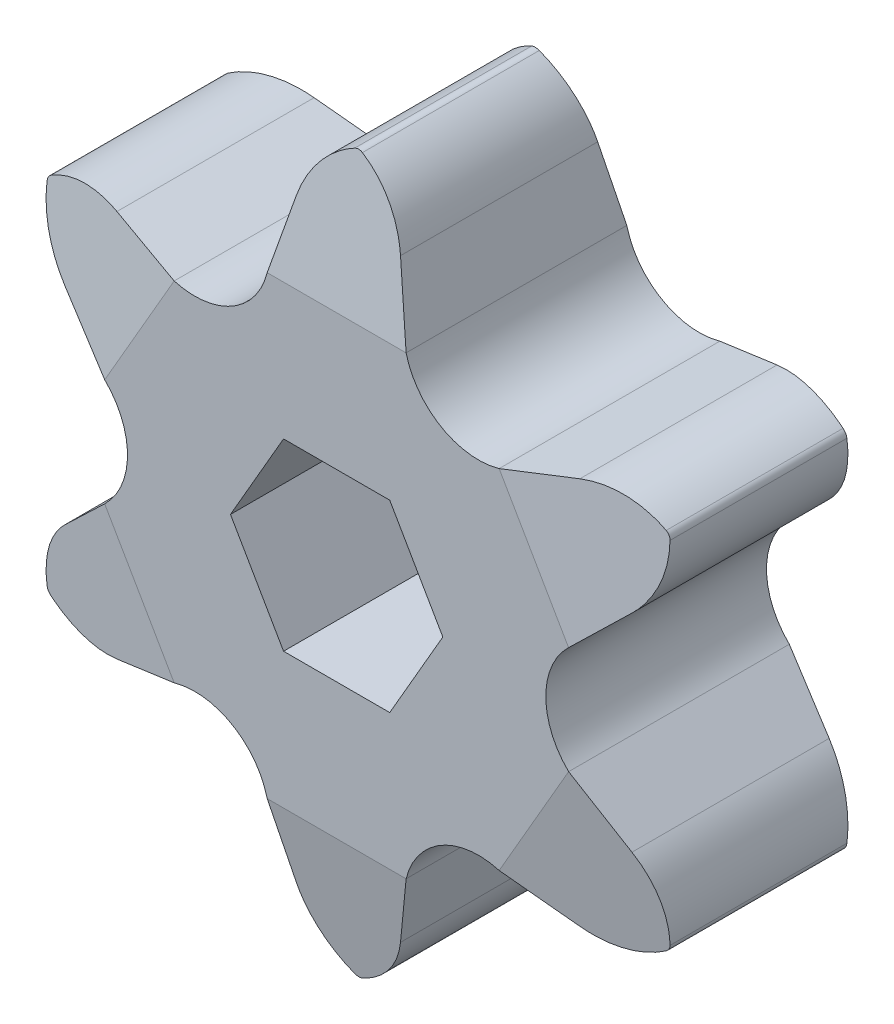
from build123d import *

# Parameters (mm, degrees)
BOSS_EXTRUDE1_DEPTH     = 3.81
CUT_EXTRUDE1_DEPTH      = 18.281637299
CIRPATTERN1_COUNT       = 6
MIRROR1_COPY_1_DEPTH    = 18.281637299
MIRROR1_COPY_2_DEPTH    = 18.281637299
MIRROR1_COPY_3_DEPTH    = 18.281637299
MIRROR1_COPY_4_DEPTH    = 18.281637299
MIRROR1_COPY_5_DEPTH    = 18.281637299
CUT_EXTRUDE2_DEPTH      = 19.498737463
CUT_EXTRUDE2_DEPTH_BACK = 19.498737463


with BuildPart() as part:
    # Sketch1 → Boss-Extrude1 (new, symmetric)
    with BuildSketch(Plane.XY):
        with BuildLine():
            Line((-5.026722801, 5.910971637), (-7.407741623, 6.593717798))
            ThreePointArc((-7.407741623, 6.593717798), (-8.766513969, 6.679662371), (-10.036356458, 6.18859332))
            ThreePointArc((-10.036356458, 6.18859332), (-10.13048223, 6.088494289), (-10.170107647, 5.956929464))
            ThreePointArc((-10.170107647, 5.956929464), (-9.960464677, 4.611679084), (-9.20664832, 3.477920001))
            Line((-9.20664832, 3.477920001), (-7.424863389, 1.757270295))
            ThreePointArc((-7.424863389, 1.757270295), (-7.270818157, 1.595014723), (-7.131420667, 1.420014312))
            ThreePointArc((-7.131420667, 1.420014312), (-6.637662134, -0.097259644), (-7.131420667, -1.6145336))
            ThreePointArc((-7.131420667, -1.6145336), (-7.270818157, -1.789534012), (-7.424863389, -1.951789584))
            Line((-7.424863389, -1.951789584), (-9.20664832, -3.67243929))
            ThreePointArc((-9.20664832, -3.67243929), (-9.960464677, -4.806198373), (-10.170107647, -6.151448752))
            ThreePointArc((-10.170107647, -6.151448752), (-10.13048223, -6.283013578), (-10.036356458, -6.383112608))
            ThreePointArc((-10.036356458, -6.383112608), (-8.766513969, -6.87418166), (-7.407741623, -6.788237086))
            Line((-7.407741623, -6.788237086), (-5.026722801, -6.105490926))
            ThreePointArc((-5.026722801, -6.105490926), (-4.809182738, -6.053211627), (-4.587929191, -6.019990065))
            ThreePointArc((-4.587929191, -6.019990065), (-3.027052134, -6.351019611), (-1.95993361, -7.537264021))
            ThreePointArc((-1.95993361, -7.537264021), (-1.878077553, -7.745485994), (-1.814582722, -7.960020865))
            Line((-1.814582722, -7.960020865), (-1.215348831, -10.363416732))
            ThreePointArc((-1.215348831, -10.363416732), (-0.610392842, -11.583120388), (0.449806676, -12.437301716))
            ThreePointArc((0.449806676, -12.437301716), (0.583557866, -12.468767511), (0.717309055, -12.437301716))
            ThreePointArc((0.717309055, -12.437301716), (1.777508573, -11.583120388), (2.382464562, -10.363416732))
            Line((2.382464562, -10.363416732), (2.981698454, -7.960020865))
            ThreePointArc((2.981698454, -7.960020865), (3.045193285, -7.745485994), (3.127049342, -7.537264021))
            ThreePointArc((3.127049342, -7.537264021), (4.194167866, -6.351019611), (5.755044922, -6.019990065))
            ThreePointArc((5.755044922, -6.019990065), (5.976298469, -6.053211627), (6.193838533, -6.105490926))
            Line((6.193838533, -6.105490926), (8.574857355, -6.788237086))
            ThreePointArc((8.574857355, -6.788237086), (9.933629701, -6.87418166), (11.203472189, -6.383112608))
            ThreePointArc((11.203472189, -6.383112608), (11.297597962, -6.283013578), (11.337223379, -6.151448752))
            ThreePointArc((11.337223379, -6.151448752), (11.127580408, -4.806198373), (10.373764051, -3.67243929))
            Line((10.373764051, -3.67243929), (8.591979121, -1.951789584))
            ThreePointArc((8.591979121, -1.951789584), (8.437933888, -1.789534012), (8.298536398, -1.6145336))
            ThreePointArc((8.298536398, -1.6145336), (7.804777866, -0.097259644), (8.298536398, 1.420014312))
            ThreePointArc((8.298536398, 1.420014312), (8.437933888, 1.595014723), (8.591979121, 1.757270295))
            Line((8.591979121, 1.757270295), (10.373764051, 3.477920001))
            ThreePointArc((10.373764051, 3.477920001), (11.127580408, 4.611679084), (11.337223379, 5.956929464))
            ThreePointArc((11.337223379, 5.956929464), (11.297597962, 6.088494289), (11.203472189, 6.18859332))
            ThreePointArc((11.203472189, 6.18859332), (9.933629701, 6.679662371), (8.574857355, 6.593717798))
            Line((8.574857355, 6.593717798), (6.193838533, 5.910971637))
            ThreePointArc((6.193838533, 5.910971637), (5.976298469, 5.858692338), (5.755044922, 5.825470777))
            ThreePointArc((5.755044922, 5.825470777), (4.194167866, 6.156500322), (3.127049342, 7.342744732))
            ThreePointArc((3.127049342, 7.342744732), (3.045193285, 7.550966706), (2.981698454, 7.765501576))
            Line((2.981698454, 7.765501576), (2.382464562, 10.168897443))
            ThreePointArc((2.382464562, 10.168897443), (1.777508573, 11.3886011), (0.717309055, 12.242782428))
            ThreePointArc((0.717309055, 12.242782428), (0.583557866, 12.274248223), (0.449806676, 12.242782428))
            ThreePointArc((0.449806676, 12.242782428), (-0.610392842, 11.3886011), (-1.215348831, 10.168897443))
            Line((-1.215348831, 10.168897443), (-1.814582722, 7.765501576))
            ThreePointArc((-1.814582722, 7.765501576), (-1.878077553, 7.550966706), (-1.95993361, 7.342744732))
            ThreePointArc((-1.95993361, 7.342744732), (-3.027052134, 6.156500322), (-4.587929191, 5.825470777))
            ThreePointArc((-4.587929191, 5.825470777), (-4.809182738, 5.858692338), (-5.026722801, 5.910971637))
        make_face()
    extrude(amount=BOSS_EXTRUDE1_DEPTH, both=True)

    # Sketch2 → Cut-Extrude1 (cut, symmetric)
    with BuildSketch(Plane(origin=(0, 0, 0), x_dir=(0, 0, -1), z_dir=(1, 0, 0))):
        Polygon((-3.048, 12.274248223), (-3.81, 7.765501576), (-3.81, 12.274248223), align=None)
    cut_extrude1 = extrude(amount=CUT_EXTRUDE1_DEPTH, both=True, mode=Mode.SUBTRACT)

    # CirPattern1: Cut-Extrude1 ×6 about axis
    cirpattern1_axis = Axis((0.583557866, -0.097259644, -4.191), (0, 0, 1))
    for i in range(1, CIRPATTERN1_COUNT):
        add(cut_extrude1.rotate(cirpattern1_axis, i * 360 / CIRPATTERN1_COUNT), mode=Mode.SUBTRACT)

    # Mirror1: Cut-Extrude1 across plane
    add(cut_extrude1.mirror(Plane.XY), mode=Mode.SUBTRACT)

    # Mirror1 copy 1 sketch → Mirror1 copy 1 (cut, symmetric)
    with BuildSketch(Plane(origin=(0.20754961, -0.554005758, 0), x_dir=(0, 0, 1), z_dir=(0.5000000000000001, 0.8660254037844386, 0))):
        Polygon((-3.048, -12.274248223), (-3.81, -7.765501576), (-3.81, -12.274248223), align=None)
    extrude(amount=MIRROR1_COPY_1_DEPTH, both=True, mode=Mode.SUBTRACT)

    # Mirror1 copy 2 sketch → Mirror1 copy 2 (cut, symmetric)
    with BuildSketch(Plane(origin=(0.791107476, -0.651265403, 0), x_dir=(0, 0, 1), z_dir=(-0.4999999999999998, 0.8660254037844387, 0))):
        Polygon((-3.048, -12.274248223), (-3.81, -7.765501576), (-3.81, -12.274248223), align=None)
    extrude(amount=MIRROR1_COPY_2_DEPTH, both=True, mode=Mode.SUBTRACT)

    # Mirror1 copy 3 sketch → Mirror1 copy 3 (cut, symmetric)
    with BuildSketch(Plane(origin=(1.167115731, -0.194519289, 0), x_dir=(0, 0, 1), z_dir=(-1, 0, 0))):
        Polygon((-3.048, -12.274248223), (-3.81, -7.765501576), (-3.81, -12.274248223), align=None)
    extrude(amount=MIRROR1_COPY_3_DEPTH, both=True, mode=Mode.SUBTRACT)

    # Mirror1 copy 4 sketch → Mirror1 copy 4 (cut, symmetric)
    with BuildSketch(Plane(origin=(0.959566121, 0.35948647, 0), x_dir=(0, 0, 1), z_dir=(-0.5000000000000004, -0.8660254037844384, 0))):
        Polygon((-3.048, -12.274248223), (-3.81, -7.765501576), (-3.81, -12.274248223), align=None)
    extrude(amount=MIRROR1_COPY_4_DEPTH, both=True, mode=Mode.SUBTRACT)

    # Mirror1 copy 5 sketch → Mirror1 copy 5 (cut, symmetric)
    with BuildSketch(Plane(origin=(0.376008256, 0.456746114, 0), x_dir=(0, 0, 1), z_dir=(0.5000000000000001, -0.8660254037844386, 0))):
        Polygon((-3.048, -12.274248223), (-3.81, -7.765501576), (-3.81, -12.274248223), align=None)
    extrude(amount=MIRROR1_COPY_5_DEPTH, both=True, mode=Mode.SUBTRACT)

    # Sketch3 → Cut-Extrude2 (cut, two sides: drawn at the far end of the back side and taken through both)
    with BuildSketch(Plane(origin=(0, 0, -3.81), x_dir=(-1, 0, 0), z_dir=(0, 0, -1)).offset(-CUT_EXTRUDE2_DEPTH_BACK)):
        Polygon((1.249529239, -3.272259644), (3.082616344, -0.097259644), (1.249529239, 3.077740356), (-2.41664497, 3.077740356), (-4.249732075, -0.097259644), (-2.41664497, -3.272259644), align=None)
    extrude(amount=CUT_EXTRUDE2_DEPTH + CUT_EXTRUDE2_DEPTH_BACK, mode=Mode.SUBTRACT)


solid = part.part
